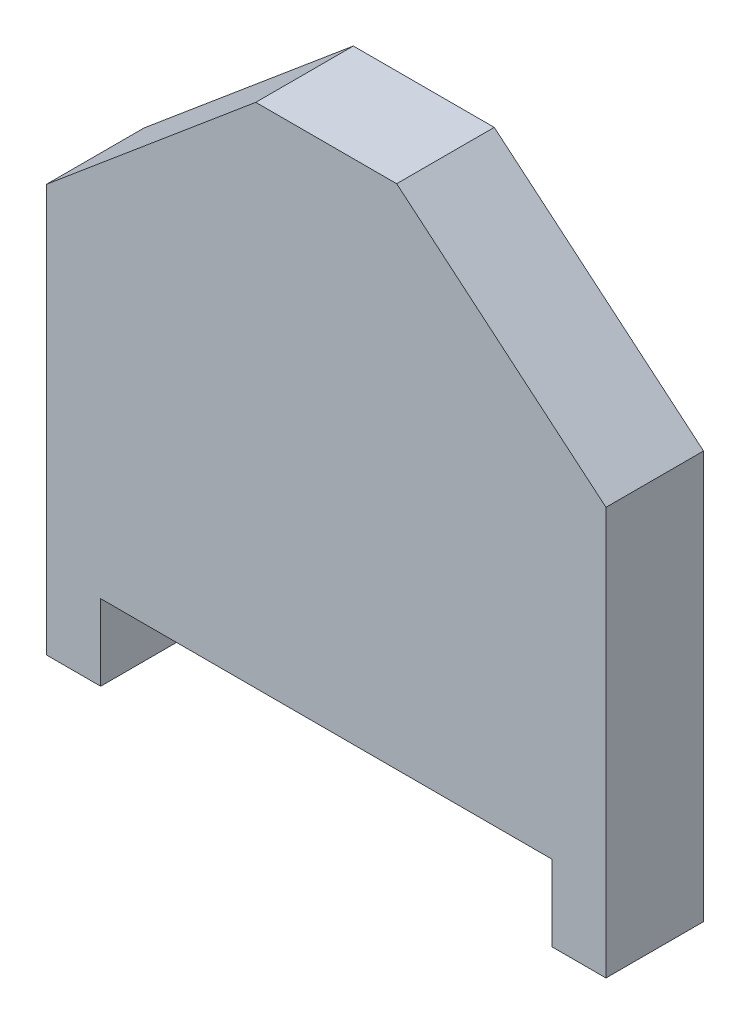
from build123d import *

# Parameters (mm, degrees)
SKETCH_3_W      = 143.043199666
SKETCH_3_H      = 233.991238821
SKETCH_3_W_2    = 65
SKETCH_3_W_3    = 50
SKETCH_3_H_2    = 70
SKETCH_3_H_3    = 233.99123882
EXTRUDE_1_DEPTH = 45


with BuildPart() as part:
    # 草图3 → 凸台-拉伸1 (new, symmetric)
    with BuildSketch(Plane.XY):
        with Locations((394.564799499, -925.525377252)):
            Rectangle(SKETCH_3_W, SKETCH_3_H)
        with Locations((290.543199666, -925.525377252)):
            Rectangle(SKETCH_3_W_2, SKETCH_3_H)
        with Locations((225.543199666, -925.525377252)):
            Rectangle(SKETCH_3_W_2, SKETCH_3_H)
        with Locations((121.521599833, -925.525377252)):
            Rectangle(SKETCH_3_W, SKETCH_3_H)
        with Locations((25, -925.525377252)):
            Rectangle(SKETCH_3_W_3, SKETCH_3_H)
        with Locations((25, -1077.520996662)):
            Rectangle(SKETCH_3_W_3, SKETCH_3_H_2)
        with Locations((491.086399332, -1077.520996662)):
            Rectangle(SKETCH_3_W_3, SKETCH_3_H_2)
        with Locations((491.086399332, -925.525377252)):
            Rectangle(SKETCH_3_W_3, SKETCH_3_H)
        Polygon((466.086399332, -694.566015103), (466.086399332, -808.529757841), (516.086399332, -808.529757841), (516.086399332, -736.520996662), align=None)
        Polygon((323.043199666, -574.538519021), (323.043199666, -808.529757841), (466.086399332, -808.529757841), (466.086399332, -694.566015103), align=None)
        with Locations((290.543199666, -691.534138431)):
            Rectangle(SKETCH_3_W_2, SKETCH_3_H_3)
        with Locations((225.543199666, -691.534138431)):
            Rectangle(SKETCH_3_W_2, SKETCH_3_H_3)
        Polygon((50, -694.566015103), (50, -808.529757841), (193.043199666, -808.529757841), (193.043199666, -574.538519021), align=None)
        Polygon((0, -736.520996662), (0, -808.529757841), (50, -808.529757841), (50, -694.566015103), align=None)
    extrude(amount=EXTRUDE_1_DEPTH, both=True)


solid = part.part
